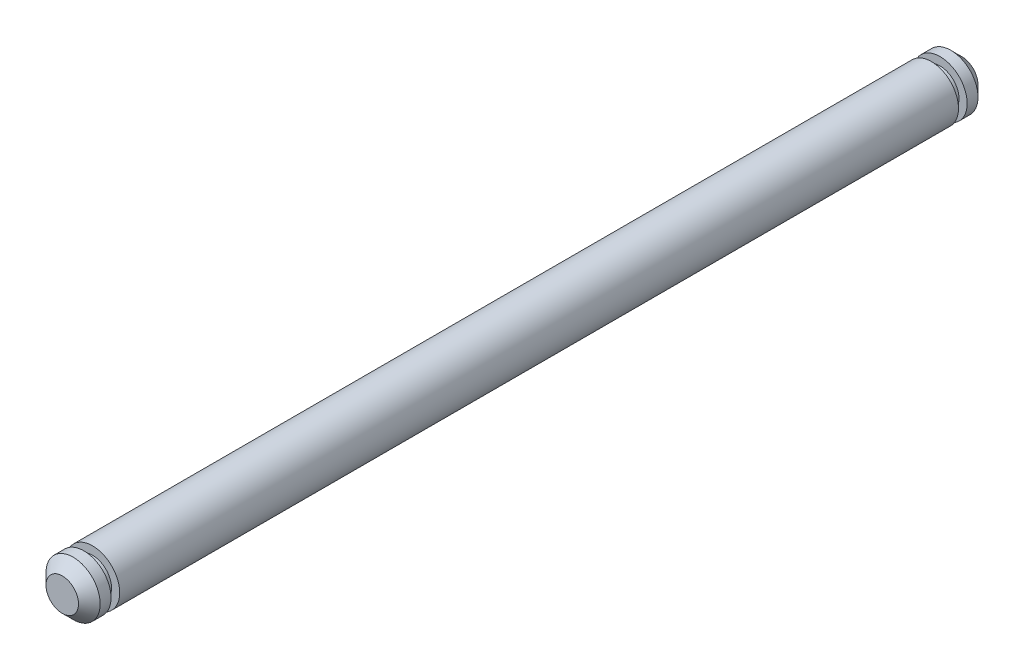
from build123d import *

# Parameters (mm, degrees)
SKETCH_1_R      = 2.5
EXTRUDE_1_DEPTH = 41.5
SKETCH_2_W      = 0.75
SKETCH_2_H      = 0.8
CHAMFER_1_SIZE  = 1


with BuildPart() as part:
    # 草图1 → 凸台-拉伸1 (new, symmetric)
    with BuildSketch(Plane.XY):
        Circle(SKETCH_1_R)
    extrude(amount=EXTRUDE_1_DEPTH, both=True)

    # 草图2 → 切除-旋转1 (revolve, cut)
    with BuildSketch(Plane(origin=(0, 0, 0), x_dir=(1, 0, 0), z_dir=(0, 1, 0))):
        with Locations((2.125, 39.1)):
            Rectangle(SKETCH_2_W, SKETCH_2_H)
        with Locations((2.125, -39.1)):
            Rectangle(SKETCH_2_W, SKETCH_2_H)
    revolve(axis=Axis((0, 0, 49.423149105), (0, 0, -1)), mode=Mode.SUBTRACT)

    # 倒角1
    chamfer_1_edges = [part.edges().sort_by_distance(p)[0] for p in [
        (-2.5, 0, -41.5),
        (-2.5, 0, 41.5),
    ]]
    chamfer(chamfer_1_edges, length=CHAMFER_1_SIZE)


solid = part.part
